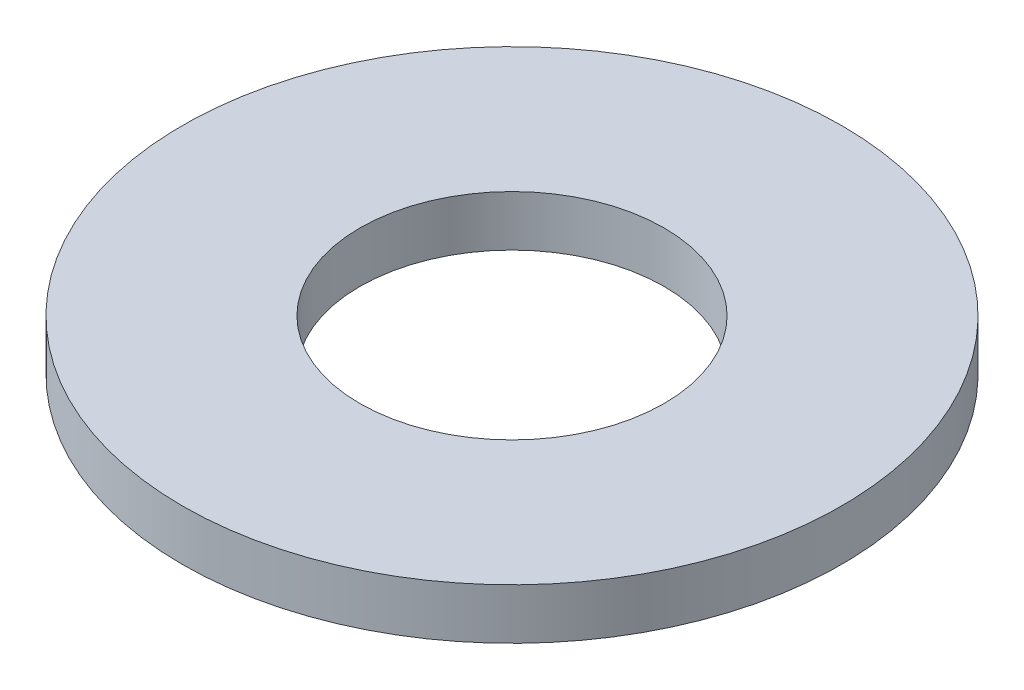
from build123d import *

# Parameters (mm, degrees)
SKETCH1_R           = 13
SKETCH1_R_2         = 6
BOSS_EXTRUDE1_DEPTH = 2


with BuildPart() as part:
    # Sketch1 → Boss-Extrude1 (new body)
    with BuildSketch(Plane(origin=(0, 0, 0), x_dir=(1, 0, 0), z_dir=(0, 1, 0))):
        with Locations(Location((0, 0, 0), (0, 0, 270))):
            Circle(SKETCH1_R)
        with Locations(Location((0, 0, 0), (0, 0, 270))):
            Circle(SKETCH1_R_2, mode=Mode.SUBTRACT)
    extrude(amount=BOSS_EXTRUDE1_DEPTH)


solid = part.part
